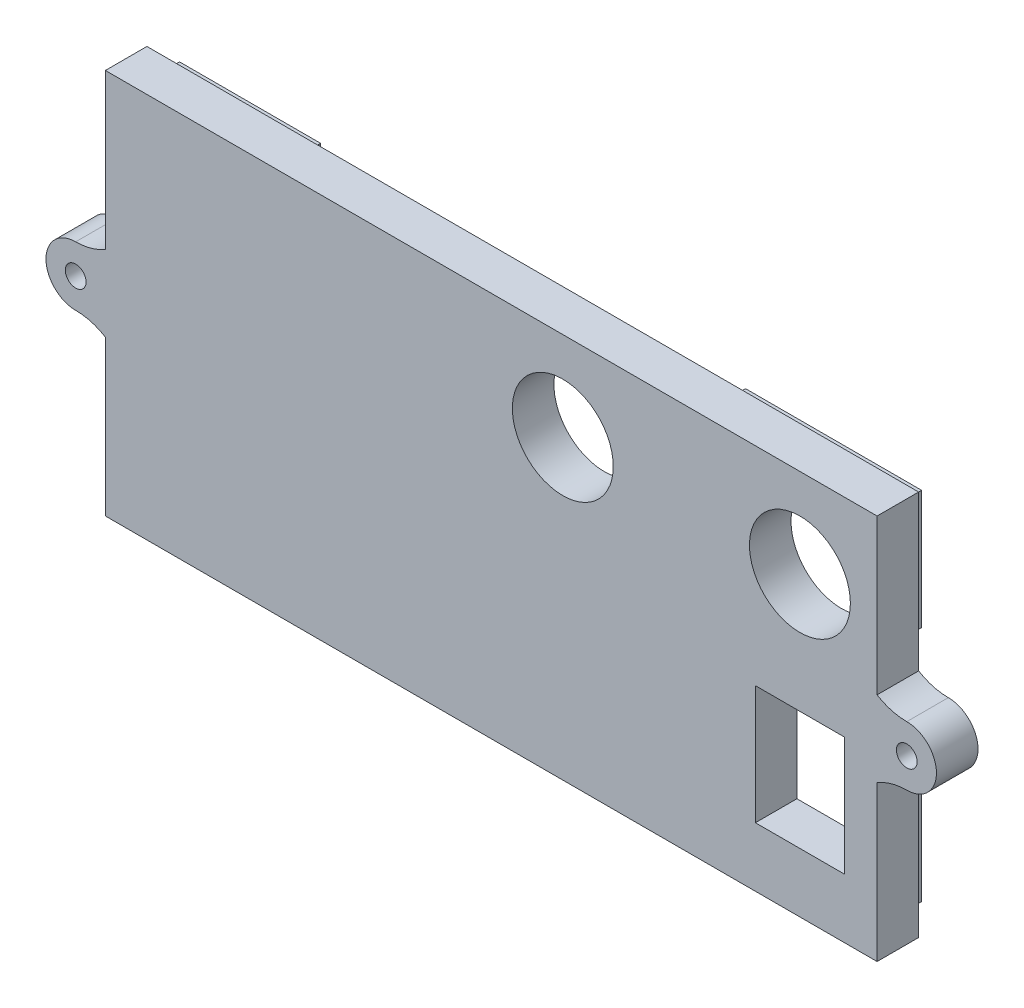
from build123d import *

# Parameters (mm, degrees)
SKETCH1_R               = 1.75
BOSS_EXTRUDE1_DEPTH     = 7
BOSS_EXTRUDE3_DEPTH     = 3
CUT_EXTRUDE1_DEPTH      = 18
CUT_EXTRUDE1_DEPTH_BACK = 23
SKETCH2_R               = 8.5
SKETCH2_W               = 15
SKETCH2_H               = 20


with BuildPart() as part:
    # Sketch1 → Boss-Extrude1 (new body)
    with BuildSketch(Plane.XY):
        with BuildLine():
            Line((128.131337811, -146.458879214), (128.131337811, -120.364170926))
            ThreePointArc((128.131337811, -120.364170926), (130.534472162, -119.316879015), (133.131337811, -118.958879214))
            ThreePointArc((133.131337811, -118.958879214), (138.131337811, -113.958879214), (133.131337811, -108.958879214))
            ThreePointArc((133.131337811, -108.958879214), (130.534472162, -108.600879413), (128.131337811, -107.553587502))
            Line((128.131337811, -107.553587502), (128.131337811, -81.458879214))
            Line((128.131337811, -81.458879214), (-1.868662189, -81.458879214))
            Line((-1.868662189, -81.458879214), (-1.868662189, -107.553587502))
            ThreePointArc((-1.868662189, -107.553587502), (-4.27179654, -108.600879413), (-6.868662189, -108.958879214))
            ThreePointArc((-6.868662189, -108.958879214), (-11.868662189, -113.958879214), (-6.868662189, -118.958879214))
            ThreePointArc((-6.868662189, -118.958879214), (-4.27179654, -119.316879015), (-1.868662189, -120.364170926))
            Line((-1.868662189, -120.364170926), (-1.868662189, -146.458879214))
            Line((-1.868662189, -146.458879214), (128.131337811, -146.458879214))
        make_face()
        with Locations((133.131337811, -113.958879214)):
            Circle(SKETCH1_R, mode=Mode.SUBTRACT)
        with Locations((-6.868662189, -113.958879214)):
            Circle(SKETCH1_R, mode=Mode.SUBTRACT)
    extrude(amount=BOSS_EXTRUDE1_DEPTH)

    # Sketch1<4> → Boss-Extrude3 (add)
    with BuildSketch(Plane.XY):
        Polygon((125.631337811, -143.958879214), (125.631337811, -121.052392275), (123.631337811, -121.052392275), (123.631337811, -141.958879214), (85.298090445, -141.958879214), (85.298090445, -143.958879214), align=None)
        Polygon((123.631337811, -103.992549868), (125.631337811, -103.992549868), (125.631337811, -83.958879214), (95.983128658, -83.958879214), (95.983128658, -85.958879214), (123.631337811, -85.958879214), align=None)
        Polygon((0.631337811, -143.958879214), (33.749338975, -143.958879214), (33.749338975, -141.958879214), (2.631337811, -141.958879214), (2.631337811, -122.590614977), (0.631337811, -122.590614977), align=None)
        Polygon((24.401857146, -85.958879214), (24.401857146, -83.958879214), (0.631337811, -83.958879214), (0.631337811, -102.239135551), (2.631337811, -102.239135551), (2.631337811, -85.958879214), align=None)
    extrude(amount=-BOSS_EXTRUDE3_DEPTH)

    # Sketch2 → Cut-Extrude1 (cut, two sides: drawn at the far end of the back side and taken through both)
    with BuildSketch(Plane.XY.offset(7).offset(-CUT_EXTRUDE1_DEPTH_BACK)):
        with Locations((115.131337811, -96.458879214)):
            Circle(SKETCH2_R)
        with Locations((75.188241038, -96.458879214)):
            Circle(SKETCH2_R)
        with Locations((115.131337811, -126.458879214)):
            Rectangle(SKETCH2_W, SKETCH2_H)
    extrude(amount=CUT_EXTRUDE1_DEPTH + CUT_EXTRUDE1_DEPTH_BACK, mode=Mode.SUBTRACT)


solid = part.part
